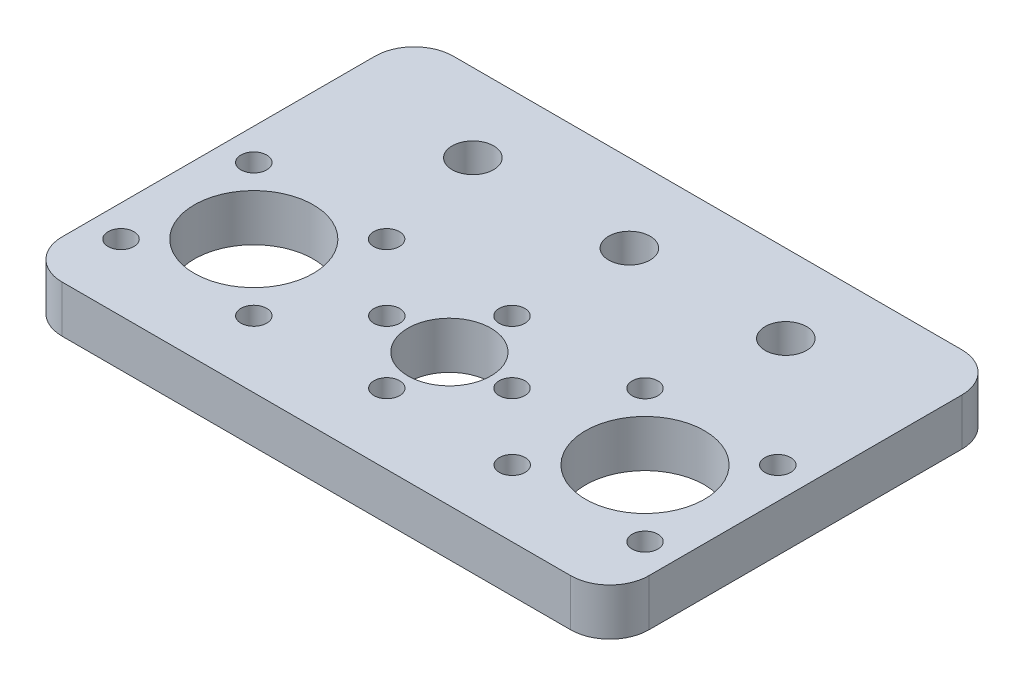
from build123d import *

# Parameters (mm, degrees)
SKETCH_1_R      = 7.6
SKETCH_1_R_2    = 1.65
SKETCH_1_R_3    = 5.3
SKETCH_1_R_4    = 2.65
EXTRUDE_1_DEPTH = 6
EXTRUDE_2_DEPTH = 1


with BuildPart() as part:
    # 草图1 → 凸台-拉伸1 (new body)
    with BuildSketch(Plane(origin=(0, 0, 0), x_dir=(1, 0, 0), z_dir=(0, 1, 0))):
        with BuildLine():
            Line((-37.5, 28), (-37.5, -12))
            ThreePointArc((-37.5, -12), (-36.035533906, -15.535533906), (-32.5, -17))
            Line((-32.5, -17), (32.5, -17))
            ThreePointArc((32.5, -17), (36.035533906, -15.535533906), (37.5, -12))
            Line((37.5, -12), (37.5, 28))
            ThreePointArc((37.5, 28), (36.035533906, 31.535533906), (32.5, 33))
            Line((32.5, 33), (-32.5, 33))
            ThreePointArc((-32.5, 33), (-36.035533906, 31.535533906), (-37.5, 28))
        make_face()
        with Locations(Location((-25, 0, 0), (0, 0, 270))):
            Circle(SKETCH_1_R, mode=Mode.SUBTRACT)
        with Locations(Location((-33.485281374, 8.485281374, 0), (0, 0, 270))):
            Circle(SKETCH_1_R_2, mode=Mode.SUBTRACT)
        with Locations(Location((-16.514718626, 8.485281374, 0), (0, 0, 270))):
            Circle(SKETCH_1_R_2, mode=Mode.SUBTRACT)
        with Locations(Location((-16.514718626, -8.485281374, 0), (0, 0, 270))):
            Circle(SKETCH_1_R_2, mode=Mode.SUBTRACT)
        with Locations(Location((-33.485281374, -8.485281374, 0), (0, 0, 270))):
            Circle(SKETCH_1_R_2, mode=Mode.SUBTRACT)
        with Locations(Location((33.485281374, -8.485281374, 0), (0, 0, 90))):
            Circle(SKETCH_1_R_2, mode=Mode.SUBTRACT)
        with Locations(Location((16.514718626, -8.485281374, 0), (0, 0, 90))):
            Circle(SKETCH_1_R_2, mode=Mode.SUBTRACT)
        with Locations(Location((16.514718626, 8.485281374, 0), (0, 0, 90))):
            Circle(SKETCH_1_R_2, mode=Mode.SUBTRACT)
        with Locations(Location((33.485281374, 8.485281374, 0), (0, 0, 90))):
            Circle(SKETCH_1_R_2, mode=Mode.SUBTRACT)
        with Locations(Location((25, 0, 0), (0, 0, 90))):
            Circle(SKETCH_1_R, mode=Mode.SUBTRACT)
        with Locations(Location((0, 0, 0), (0, 0, 270))):
            Circle(SKETCH_1_R_3, mode=Mode.SUBTRACT)
        with Locations(Location((0, 8, 0), (0, 0, 270))):
            Circle(SKETCH_1_R_2, mode=Mode.SUBTRACT)
        with Locations(Location((8, 0, 0), (0, 0, 270))):
            Circle(SKETCH_1_R_2, mode=Mode.SUBTRACT)
        with Locations(Location((0, -8, 0), (0, 0, 270))):
            Circle(SKETCH_1_R_2, mode=Mode.SUBTRACT)
        with Locations(Location((-8, 0, 0), (0, 0, 270))):
            Circle(SKETCH_1_R_2, mode=Mode.SUBTRACT)
        with Locations(Location((-20, 23, 0), (0, 0, 270))):
            Circle(SKETCH_1_R_4, mode=Mode.SUBTRACT)
        with Locations(Location((0, 23, 0), (0, 0, 270))):
            Circle(SKETCH_1_R_4, mode=Mode.SUBTRACT)
        with Locations(Location((20, 23, 0), (0, 0, 270))):
            Circle(SKETCH_1_R_4, mode=Mode.SUBTRACT)
    extrude(amount=EXTRUDE_1_DEPTH)

    # 草图2 → 凸台-拉伸2 (add)
    with BuildSketch(Plane(origin=(0, 0, 0), x_dir=(1, 0, 0), z_dir=(0, 1, 0))):
        with BuildLine():
            Line((23.852134149, -14.903628183), (24.266794282, -13.037657588))
            add(Edge.make_bspline(
                [(24.266794282, -13.037657588), (24.271883814, -13.015748045), (24.281271316, -12.975336496), (24.295908412, -12.920641787), (24.306528391, -12.876102866), (24.320129815, -12.830793522), (24.334837602, -12.778584386), (24.357979635, -12.720418554), (24.377880976, -12.66753535), (24.391033522, -12.635652992), (24.396562021, -12.622251664)],
                knots=[0, 0, 0, 0, 1.238322188, 2.284051206, 3.117304464, 3.758429334, 4.888539964, 6.101256058, 7.201888128, 8, 8, 8, 8], degree=3))
            Line((24.396562021, -12.622251664), (24.435343184, -12.537231421))
            Line((24.435343184, -12.537231421), (24.367476148, -12.435057972))
            Line((24.367476148, -12.435057972), (23.995326138, -12.655812287))
            add(Edge.make_bspline(
                [(23.995326138, -12.655812287), (23.998659603, -12.676421552), (24.004429341, -12.712093154), (24.011088535, -12.76131351), (24.011074305, -12.806476397), (24.010481179, -12.846575507), (24.006384099, -12.886091723), (24.000882922, -12.92533846), (23.99372329, -12.973421465), (23.987016689, -13.00834772), (23.983393472, -13.027216506)],
                knots=[0, 0, 0, 0, 1.338411387, 2.316592945, 3.17702585, 4.228968444, 4.885249272, 5.721144607, 6.768856447, 8, 8, 8, 8], degree=3))
            Line((23.983393472, -13.027216506), (23.728332743, -14.588904125))
            Line((23.728332743, -14.588904125), (23.441202975, -13.016029631))
            add(Edge.make_bspline(
                [(23.441202975, -13.016029631), (23.435119549, -12.988252053), (23.422579973, -12.930995007), (23.41069226, -12.843342713), (23.398957043, -12.757699998), (23.393787373, -12.690152104), (23.390367287, -12.642657093), (23.389461329, -12.614272985), (23.387198326, -12.591951032), (23.38741335, -12.579247691), (23.38750598, -12.57377521)],
                knots=[0, 0, 0, 0, 1.529030851, 3.151743129, 4.755722009, 6.178359585, 6.794824103, 7.317056175, 7.705794154, 8, 8, 8, 8], degree=3))
            Line((23.38750598, -12.57377521), (23.392726521, -12.472347552))
            Line((23.392726521, -12.472347552), (23.241330825, -12.420142139))
            Line((23.241330825, -12.420142139), (23.046679217, -12.804970607))
            add(Edge.make_bspline(
                [(23.046679217, -12.804970607), (23.052684285, -12.814641906), (23.063749535, -12.832462741), (23.078173733, -12.856882573), (23.090456256, -12.875803456), (23.102876851, -12.895013133), (23.115821263, -12.919684238), (23.129497068, -12.948117568), (23.141909705, -12.981815511), (23.153313044, -13.023049743), (23.167395421, -13.07932329), (23.177496337, -13.121918041), (23.18315908, -13.145797371)],
                knots=[0, 0, 0, 0, 0.921907577, 1.698754621, 2.296307198, 2.748718929, 3.550470391, 4.55020495, 5.30186169, 6.455026243, 8.012628348, 10, 10, 10, 10], degree=3))
            Line((23.18315908, -13.145797371), (23.518019511, -14.579208835))
            add(Edge.make_bspline(
                [(23.518019511, -14.579208835), (23.51878368, -14.581689672), (23.521429665, -14.590279728), (23.525654502, -14.608955967), (23.531271337, -14.63920481), (23.540812289, -14.680749621), (23.550659646, -14.734368561), (23.563531074, -14.799213477), (23.578489524, -14.875524878), (23.594857821, -14.960104444), (23.612054048, -15.046410855), (23.629010784, -15.127503713), (23.645672922, -15.200291593), (23.660832382, -15.264876869), (23.676512702, -15.321363263), (23.692273851, -15.369164193), (23.705890287, -15.409402907), (23.724759583, -15.450485202), (23.749378725, -15.494369686), (23.783178315, -15.540674488), (23.820420602, -15.582292452), (23.862924426, -15.617865913), (23.911445868, -15.648369456), (23.969376059, -15.668254694), (24.035154691, -15.683001244), (24.082240889, -15.685912368), (24.107194878, -15.687455159)],
                knots=[0, 0, 0, 0, 0.136147877, 0.471420703, 1.003374956, 1.750226953, 2.706735297, 3.862724125, 5.218194133, 6.785943471, 8.381806232, 9.834531584, 11.131596252, 12.298711875, 13.314372995, 14.205152041, 14.939373808, 15.540515836, 16.574101771, 17.573134416, 18.54244681, 19.495838758, 20.473188126, 21.52939635, 22.690669055, 24, 24, 24, 24], degree=3))
            add(Edge.make_bspline(
                [(24.107194878, -15.687455159), (24.133808767, -15.688833357), (24.187157137, -15.691595998), (24.254196652, -15.677913141), (24.304535412, -15.653032005), (24.340836259, -15.624054145), (24.373588938, -15.584020902), (24.40357785, -15.535466639), (24.428921123, -15.479174065), (24.446199082, -15.417018003), (24.458093232, -15.350558139), (24.459320939, -15.304671459), (24.459954307, -15.280998734)],
                knots=[0, 0, 0, 0, 1.286899443, 2.57963011, 3.251935945, 3.988213668, 4.80743426, 5.741876491, 6.74319247, 7.782291109, 8.855894274, 10, 10, 10, 10], degree=3))
            Line((24.459954307, -15.280998734), (24.469649598, -15.073668668))
            Line((24.469649598, -15.073668668), (24.281710114, -15.073668668))
            add(Edge.make_bspline(
                [(24.281710114, -15.073668668), (24.275017134, -15.098284868), (24.262563384, -15.144088678), (24.245048533, -15.207421381), (24.228566053, -15.260140198), (24.21351833, -15.302861025), (24.200479111, -15.337385972), (24.186587096, -15.363763526), (24.174475948, -15.384335349), (24.157292634, -15.403660924), (24.125960546, -15.415006646), (24.091137296, -15.41582291), (24.058864552, -15.408557542), (24.033019817, -15.395159), (24.006356265, -15.377037919), (23.979754427, -15.351952413), (23.954544743, -15.317616992), (23.934292351, -15.271787378), (23.917271496, -15.215406681), (23.909838678, -15.173711616), (23.905831145, -15.151230995)],
                knots=[0, 0, 0, 0, 1.79404273, 3.338207843, 4.621043795, 5.677144978, 6.524489655, 7.212578166, 7.770396117, 8.203257492, 9.002141715, 10.016764564, 10.627423213, 11.307693552, 12.049644943, 12.890653229, 13.866266954, 15.023854564, 16.3953594, 18, 18, 18, 18], degree=3))
            Line((23.905831145, -15.151230995), (23.780538155, -14.899153433))
            Line((23.780538155, -14.899153433), (23.852134149, -14.903628183))
        make_face()
        with BuildLine():
            Line((25.372803231, -13.555982753), (24.889530271, -14.523274464))
            add(Edge.make_bspline(
                [(24.889530271, -14.523274464), (24.877892751, -14.547659885), (24.856343016, -14.5928155), (24.825796127, -14.655105919), (24.799241472, -14.706004047), (24.776720694, -14.747110398), (24.757294696, -14.781474269), (24.747474507, -14.815385975), (24.741469825, -14.848197356), (24.742497159, -14.879532297), (24.747551148, -14.907370542), (24.755263731, -14.930593876), (24.7673791, -14.948020785), (24.78762672, -14.96160253), (24.814679632, -14.968838194), (24.83605859, -14.969626804), (24.846274358, -14.970003635)],
                knots=[0, 0, 0, 0, 2.078763659, 3.849343132, 5.337860138, 6.493364119, 7.459938902, 8.361301002, 9.194546773, 10.017188772, 10.756206604, 11.367342629, 11.887627112, 12.354553205, 13.213736046, 14, 14, 14, 14], degree=3))
            add(Edge.make_bspline(
                [(24.846274358, -14.970003635), (24.853810229, -14.969693482), (24.868865372, -14.969073858), (24.891899396, -14.959555111), (24.915847679, -14.940729735), (24.933569602, -14.92628049), (24.943973058, -14.917798223)],
                knots=[0, 0, 0, 0, 0.791936643, 1.582128931, 2.580615944, 4, 4, 4, 4], degree=3))
            Line((24.943973058, -14.917798223), (25.056587591, -14.834269563))
            add(Edge.make_bspline(
                [(25.056587591, -14.834269563), (25.073903963, -14.822076408), (25.104232533, -14.800720842), (25.141545202, -14.770259432), (25.166910037, -14.749496966), (25.181992964, -14.732437112), (25.185198642, -14.714175075), (25.189476256, -14.693538971), (25.191013883, -14.665960046), (25.192291162, -14.63264926), (25.194497087, -14.594036988), (25.203293274, -14.551366479), (25.216807812, -14.505339386), (25.234618701, -14.457616356), (25.253392845, -14.410772135), (25.271588408, -14.367744084), (25.286586179, -14.329450584), (25.297604742, -14.30644426), (25.30269882, -14.295808025)],
                knots=[0, 0, 0, 0, 1.645052863, 2.881209681, 3.72933552, 4.211973671, 4.591267077, 5.140372713, 5.8570213, 6.726627572, 7.733480627, 8.854199255, 10.100564973, 11.456357308, 12.807882021, 14.01967868, 15.084462014, 16, 16, 16, 16], degree=3))
            Line((25.30269882, -14.295808025), (25.520469969, -13.765550194))
            Line((25.520469969, -13.765550194), (25.892619979, -14.633651622))
            Line((25.892619979, -14.633651622), (26.002251345, -14.847693812))
            add(Edge.make_bspline(
                [(26.002251345, -14.847693812), (26.013832253, -14.863917486), (26.039090501, -14.899301719), (26.081755037, -14.933815401), (26.117336829, -14.959889273), (26.14315458, -14.968692578), (26.166299864, -14.972293466), (26.189674031, -14.959668285), (26.209832211, -14.938709791), (26.223442535, -14.913460028), (26.228214531, -14.890134349), (26.229200616, -14.86734613), (26.229198418, -14.838976656), (26.228088488, -14.818108148), (26.22748041, -14.806675274)],
                knots=[0, 0, 0, 0, 1.782153251, 3.886920354, 4.902597257, 5.70769203, 6.334505672, 6.92401641, 7.997682522, 8.926431573, 9.452001144, 10.123367458, 10.971881293, 12, 12, 12, 12], degree=3))
            Line((26.22748041, -14.806675274), (26.217785119, -14.678399118))
            Line((26.217785119, -14.678399118), (26.202869287, -14.506867049))
            add(Edge.make_bspline(
                [(26.202869287, -14.506867049), (26.201651958, -14.495198661), (26.1994675, -14.474260104), (26.192300616, -14.442991092), (26.166530445, -14.417165647), (26.124385871, -14.403254544), (26.07509994, -14.375972909), (26.031691184, -14.323120132), (25.991813284, -14.25216066), (25.966320092, -14.198063855), (25.952283308, -14.16827766)],
                knots=[0, 0, 0, 0, 0.642751124, 1.153396727, 1.710076852, 2.535343349, 3.556724644, 4.738478284, 6.204176356, 8, 8, 8, 8], degree=3))
            Line((25.952283308, -14.16827766), (25.674103039, -13.579848085))
            Line((25.674103039, -13.579848085), (25.966453348, -12.968298969))
            add(Edge.make_bspline(
                [(25.966453348, -12.968298969), (25.980371261, -12.939711054), (26.005481284, -12.888134122), (26.039060828, -12.819245103), (26.067204687, -12.768577506), (26.092430141, -12.72258766), (26.122313126, -12.678232439), (26.159245328, -12.633909843), (26.191232125, -12.596743008), (26.210787136, -12.575482311), (26.218530911, -12.567063086)],
                knots=[0, 0, 0, 0, 1.601435843, 2.889232983, 3.858462789, 4.520012265, 5.530494073, 6.545310076, 7.42394354, 8, 8, 8, 8], degree=3))
            Line((26.218530911, -12.567063086), (26.276702656, -12.505162382))
            Line((26.276702656, -12.505162382), (26.231955159, -12.385835726))
            Line((26.231955159, -12.385835726), (25.822515569, -12.486517592))
            add(Edge.make_bspline(
                [(25.822515569, -12.486517592), (25.822638204, -12.505135924), (25.822836216, -12.535197759), (25.821849417, -12.574440509), (25.813625936, -12.605201739), (25.80644243, -12.633760072), (25.794545036, -12.667486746), (25.777847798, -12.709440753), (25.755504375, -12.768221941), (25.738271545, -12.812689319), (25.728545826, -12.837785438)],
                knots=[0, 0, 0, 0, 1.21816483, 1.966893151, 2.550031029, 3.290789217, 3.891750533, 4.884120903, 6.241486722, 8, 8, 8, 8], degree=3))
            Line((25.728545826, -12.837785438), (25.523453135, -13.36878906))
            Line((25.523453135, -13.36878906), (25.27957928, -12.754256778))
            add(Edge.make_bspline(
                [(25.27957928, -12.754256778), (25.272964688, -12.739792734), (25.260615861, -12.712789714), (25.242235366, -12.676316069), (25.229202052, -12.644970487), (25.212945934, -12.61061019), (25.195263923, -12.564909415), (25.179064396, -12.505890263), (25.163862464, -12.44988691), (25.157591409, -12.414462913), (25.155032083, -12.400005766)],
                knots=[0, 0, 0, 0, 1.012323175, 1.889912785, 2.598438302, 3.17202093, 4.309212077, 5.711164048, 7.065886393, 8, 8, 8, 8], degree=3))
            Line((25.155032083, -12.400005766), (25.14906575, -12.279187526))
            Line((25.14906575, -12.279187526), (24.966346807, -12.262034319))
            Line((24.966346807, -12.262034319), (24.868648106, -12.757985736))
            add(Edge.make_bspline(
                [(24.868648106, -12.757985736), (24.882306436, -12.76272798), (24.905912113, -12.770923994), (24.935918964, -12.781071359), (24.95426982, -12.788241344), (24.964885772, -12.791357938), (24.970755925, -12.796365132), (24.977035405, -12.804195273), (24.988087772, -12.815333097), (25.001997771, -12.831402536), (25.017603588, -12.853412821), (25.035333802, -12.88138687), (25.052287839, -12.917148459), (25.06432037, -12.943183601), (25.070757631, -12.957112095)],
                knots=[0, 0, 0, 0, 1.736427007, 3.001064989, 3.793959489, 4.11535666, 4.306432151, 4.707901453, 5.320187133, 6.187631058, 7.256088104, 8.556141407, 10.157576345, 12, 12, 12, 12], degree=3))
            Line((25.070757631, -12.957112095), (25.372803231, -13.555982753))
        make_face()
        with BuildLine():
            Line((27.632551793, -12.440278513), (27.431933851, -12.440278513))
            Line((27.431933851, -12.440278513), (27.153007791, -14.332351813))
            Line((27.153007791, -14.332351813), (26.924049768, -12.947416804))
            add(Edge.make_bspline(
                [(26.924049768, -12.947416804), (26.916499189, -12.912927463), (26.902479502, -12.848888702), (26.887853528, -12.758654744), (26.877203437, -12.682296679), (26.872473444, -12.63568975), (26.870352773, -12.614793748)],
                knots=[0, 0, 0, 0, 1.256363384, 2.332777349, 3.252508405, 4, 4, 4, 4], degree=3))
            Line((26.870352773, -12.614793748), (26.870352773, -12.505908174))
            Line((26.870352773, -12.505908174), (26.863640648, -12.399259975))
            Line((26.863640648, -12.399259975), (26.712244953, -12.356004062))
            Line((26.712244953, -12.356004062), (26.548916591, -12.737849363))
            add(Edge.make_bspline(
                [(26.548916591, -12.737849363), (26.555017872, -12.746877839), (26.56610342, -12.76328187), (26.582525071, -12.784290405), (26.59272771, -12.801958528), (26.603171703, -12.814490064), (26.610541555, -12.829526973), (26.618721928, -12.849620686), (26.627096789, -12.877609574), (26.63798127, -12.91019988), (26.647491574, -12.943652526), (26.655776487, -12.97328045), (26.662510361, -12.996575838), (26.666030009, -13.010305372), (26.667497457, -13.016029631)],
                knots=[0, 0, 0, 0, 1.283274893, 2.331609754, 3.135583168, 3.680203769, 4.243396287, 5.097018049, 6.235891526, 7.680387388, 9.144336631, 10.33076792, 11.304046475, 12, 12, 12, 12], degree=3))
            Line((26.667497457, -13.016029631), (27.059038049, -14.887220767))
            Line((27.059038049, -14.887220767), (27.273080239, -14.887220767))
            Line((27.273080239, -14.887220767), (27.536344676, -13.083896668))
            Line((27.536344676, -13.083896668), (27.804829653, -14.887220767))
            Line((27.804829653, -14.887220767), (28.034533468, -14.887220767))
            Line((28.034533468, -14.887220767), (28.376851814, -12.967553177))
            add(Edge.make_bspline(
                [(28.376851814, -12.967553177), (28.384383038, -12.935499214), (28.398439776, -12.875671729), (28.417090164, -12.791496103), (28.433251273, -12.717777746), (28.453347853, -12.655124984), (28.471002678, -12.601424842), (28.482690594, -12.569030351), (28.487974763, -12.554384628)],
                knots=[0, 0, 0, 0, 1.383701415, 2.582625292, 3.62413832, 4.552797255, 5.345711924, 6, 6, 6, 6], degree=3))
            Line((28.487974763, -12.554384628), (28.515569052, -12.47160176))
            Line((28.515569052, -12.47160176), (28.452176766, -12.370919894))
            Line((28.452176766, -12.370919894), (28.110604211, -12.614793748))
            add(Edge.make_bspline(
                [(28.110604211, -12.614793748), (28.113530052, -12.635423658), (28.118424846, -12.669936518), (28.12583223, -12.717531769), (28.125352127, -12.764471256), (28.125863904, -12.821532344), (28.117926645, -12.893269811), (28.107337854, -12.944520837), (28.101654712, -12.972027927)],
                knots=[0, 0, 0, 0, 1.04221277, 1.743572458, 2.402350692, 3.384207066, 4.596070008, 6, 6, 6, 6], degree=3))
            Line((28.101654712, -12.972027927), (27.915952602, -14.342047104))
            Line((27.915952602, -14.342047104), (27.632551793, -12.440278513))
        make_face()
    extrude(amount=-EXTRUDE_2_DEPTH)


solid = part.part
